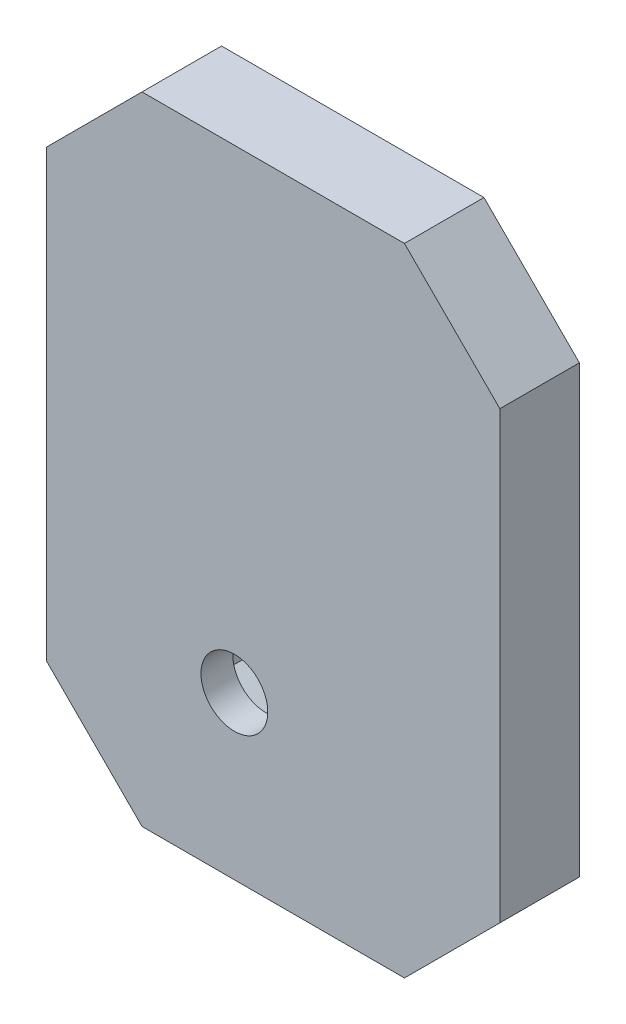
from build123d import *

# Parameters (mm, degrees)
SKETCH1_W           = 28.5
SKETCH1_H           = 40
BOSS_EXTRUDE1_DEPTH = 5
SKETCH2_W           = 28.5
SKETCH2_H           = 40
SKETCH2_R           = 2.1
BOSS_EXTRUDE2_DEPTH = 2
CHAMFER1_SIZE       = 6


with BuildPart() as part:
    # Sketch1 → Boss-Extrude1 (new body)
    with BuildSketch(Plane(origin=(0, 0, 444.620141885), x_dir=(-1, 0, 0), z_dir=(0, 0, -1))):
        with Locations((146.960843614, -510.298939869)):
            Rectangle(SKETCH1_W, SKETCH1_H)
        Polygon((149.40344611, -524.327662084), (153.05344611, -522.220333602), (153.05344611, -518.005676636), (149.40344611, -515.898348154), (145.75344611, -518.005676636), (145.75344611, -522.220333602), align=None, mode=Mode.SUBTRACT)
    extrude(amount=BOSS_EXTRUDE1_DEPTH)

    # Sketch2 → Boss-Extrude2 (add)
    with BuildSketch(Plane(origin=(0, 0, 444.620141885), x_dir=(-1, 0, 0), z_dir=(0, 0, -1))):
        with Locations((146.960843614, -510.298939869)):
            Rectangle(SKETCH2_W, SKETCH2_H)
        with Locations((149.40344611, -520.113005119)):
            Circle(SKETCH2_R, mode=Mode.SUBTRACT)
    extrude(amount=BOSS_EXTRUDE2_DEPTH)

    # Chamfer1
    chamfer1_edges = [part.edges().sort_by_distance(p)[0] for p in [
        (-161.210843614, -530.298939869, 442.120141885),
        (-132.710843614, -530.298939869, 442.120141885),
        (-132.710843614, -490.298939869, 442.120141885),
        (-161.210843614, -490.298939869, 442.120141885),
    ]]
    chamfer(chamfer1_edges, length=CHAMFER1_SIZE)


solid = part.part
